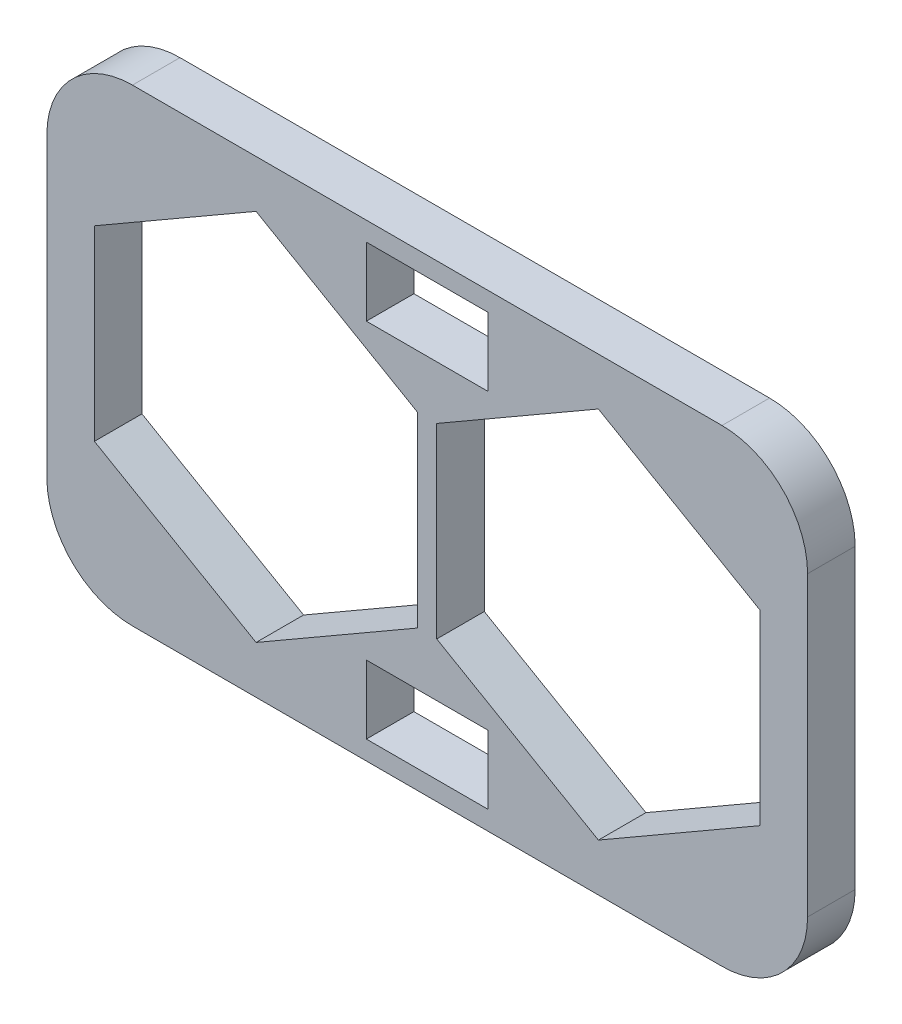
from build123d import *

# Parameters (mm, degrees)
SKETCH1_W           = 8.128
SKETCH1_H           = 4.572
BOSS_EXTRUDE1_DEPTH = 3.175


with BuildPart() as part:
    # Sketch1 → Boss-Extrude1 (new body)
    with BuildSketch(Plane.XY):
        with BuildLine():
            Line((-8.255, 15.639992312), (31.115, 15.639992312))
            ThreePointArc((31.115, 15.639992312), (35.156115254, 13.966107566), (36.83, 9.924992312))
            Line((36.83, 9.924992312), (36.83, -9.924992312))
            ThreePointArc((36.83, -9.924992312), (35.156115254, -13.966107566), (31.115, -15.639992312))
            Line((31.115, -15.639992312), (-8.255, -15.639992312))
            ThreePointArc((-8.255, -15.639992312), (-12.296115254, -13.966107566), (-13.97, -9.924992312))
            Line((-13.97, -9.924992312), (-13.97, 9.924992312))
            ThreePointArc((-13.97, 9.924992312), (-12.296115254, 13.966107566), (-8.255, 15.639992312))
        make_face()
        Polygon((12.065, -6.232496156), (22.86, -12.464992312), (33.655, -6.232496156), (33.655, 6.232496156), (22.86, 12.464992312), (12.065, 6.232496156), align=None, mode=Mode.SUBTRACT)
        Polygon((-10.795, -6.232496156), (0, -12.464992312), (10.795, -6.232496156), (10.795, 6.232496156), (0, 12.464992312), (-10.795, 6.232496156), align=None, mode=Mode.SUBTRACT)
        with Locations((11.43, 12.083992312)):
            Rectangle(SKETCH1_W, SKETCH1_H, mode=Mode.SUBTRACT)
        with Locations((11.43, -12.083992312)):
            Rectangle(SKETCH1_W, SKETCH1_H, mode=Mode.SUBTRACT)
    extrude(amount=BOSS_EXTRUDE1_DEPTH)


solid = part.part
